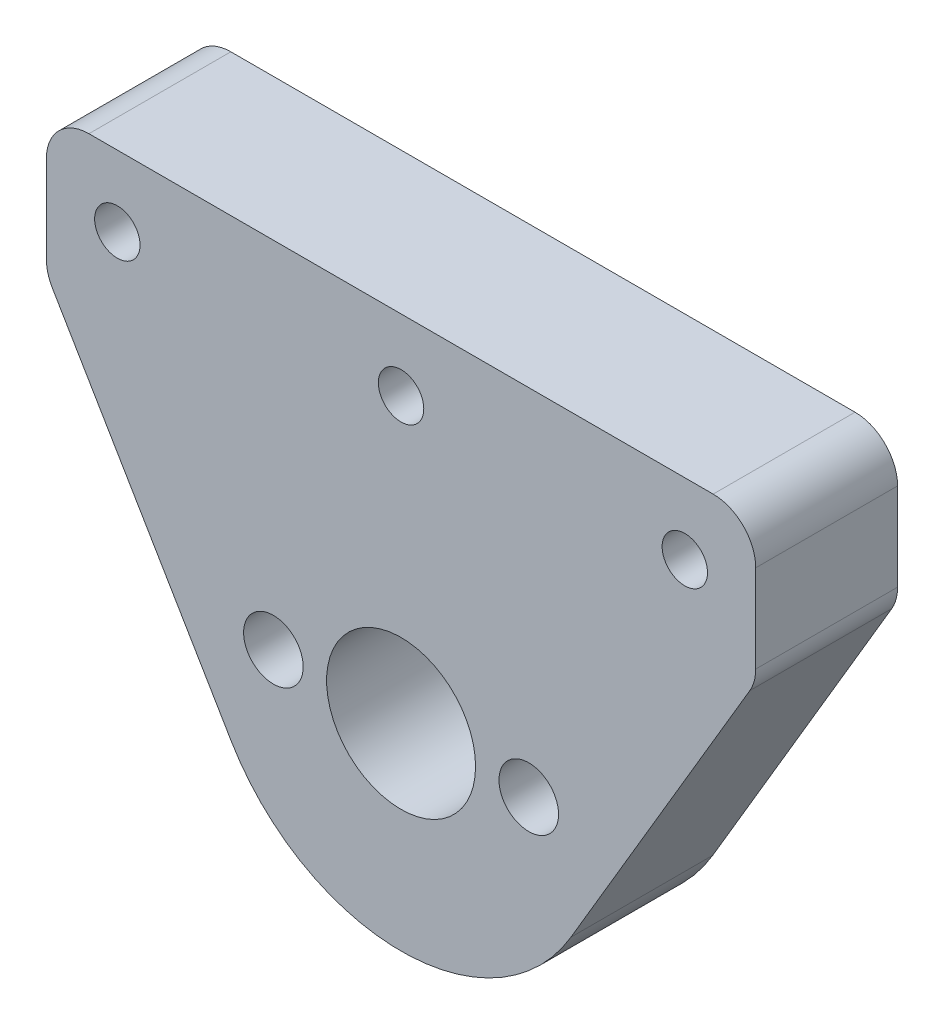
from build123d import *

# Parameters (mm, degrees)
SKETCH_1_R          = 13.9
SKETCH_1_R_2        = 2.1
SKETCH_1_W          = 50
SKETCH_1_H          = 10
SKETCH_1_R_3        = 1.6
EXTRUDE_1_DEPTH     = 10
FILLET_1_R          = 3
SKETCH_2_R          = 5.25
CUT_EXTRUDE_1_DEPTH = 44.292147094


with BuildPart() as part:
    # ｽｹｯﾁ1 → ﾎﾞｽ - 押し出し1 (new body)
    # profile 1 of 3: a face of its own
    with BuildSketch(Plane.XY):
        with Locations((0, -20)):
            Circle(SKETCH_1_R)
        with Locations((-9, -20)):
            Circle(SKETCH_1_R_2, mode=Mode.SUBTRACT)
        with Locations((9, -20)):
            Circle(SKETCH_1_R_2, mode=Mode.SUBTRACT)
    # profile 2 of 3: a face of its own
    with BuildSketch(Plane.XY):
        with BuildLine():
            Line((25, -5), (-25, -5))
            Line((-25, -5), (-11.969023725, -27.067706209))
            ThreePointArc((-11.969023725, -27.067706209), (-3.66337073, -6.591431288), (13.9, -20))
            ThreePointArc((13.9, -20), (13.408568712, -23.66337073), (11.969023725, -27.067706209))
            Line((11.969023725, -27.067706209), (25, -5))
        make_face()
    # profile 3 of 3: a face of its own
    with BuildSketch(Plane.XY):
        Rectangle(SKETCH_1_W, SKETCH_1_H)
        Circle(SKETCH_1_R_3, mode=Mode.SUBTRACT)
        with Locations((-20, 0)):
            Circle(SKETCH_1_R_3, mode=Mode.SUBTRACT)
        with Locations((20, 0)):
            Circle(SKETCH_1_R_3, mode=Mode.SUBTRACT)
    extrude(amount=EXTRUDE_1_DEPTH)

    # ﾌｨﾚｯﾄ1
    fillet_1_edges = [part.edges().sort_by_distance(p)[0] for p in [
        (-25, -5, 5),
        (-25, 5, 5),
        (25, 5, 5),
        (25, -5, 5),
    ]]
    fillet(fillet_1_edges, radius=FILLET_1_R)

    # ｽｹｯﾁ2 → ｶｯﾄ - 押し出し1 (cut, through all)
    with BuildSketch(Plane.XY.offset(10)):
        with Locations((0, -20)):
            Circle(SKETCH_2_R)
    extrude(amount=-CUT_EXTRUDE_1_DEPTH, mode=Mode.SUBTRACT)


solid = part.part
